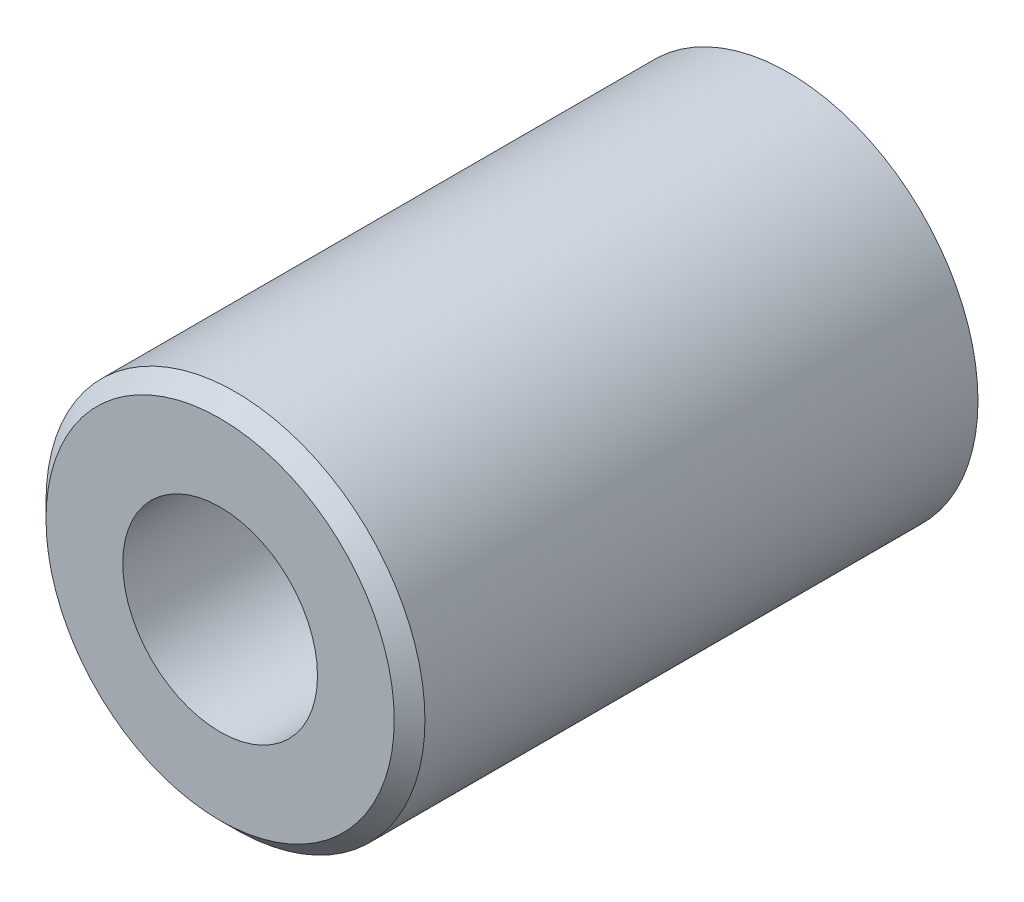
from build123d import *

# Parameters (mm, degrees)
SKETCH1_R      = 6.35
SKETCH1_R_2    = 3.2639
EXTRUDE1_DEPTH = 9.525
CHAMFER1_SIZE  = 0.51435


with BuildPart() as part:
    # Sketch1 → Extrude1 (new, symmetric)
    with BuildSketch(Plane.XY):
        with Locations(Location((0, 0, 0), (0, 0, 180))):
            Circle(SKETCH1_R)
        with Locations(Location((0, 0, 0), (0, 0, 180))):
            Circle(SKETCH1_R_2, mode=Mode.SUBTRACT)
    extrude(amount=EXTRUDE1_DEPTH, both=True)

    # Chamfer1
    chamfer1_edges = [part.edges().sort_by_distance(p)[0] for p in [
        (6.35, 0, 9.525),
    ]]
    chamfer(chamfer1_edges, length=CHAMFER1_SIZE)


solid = part.part
